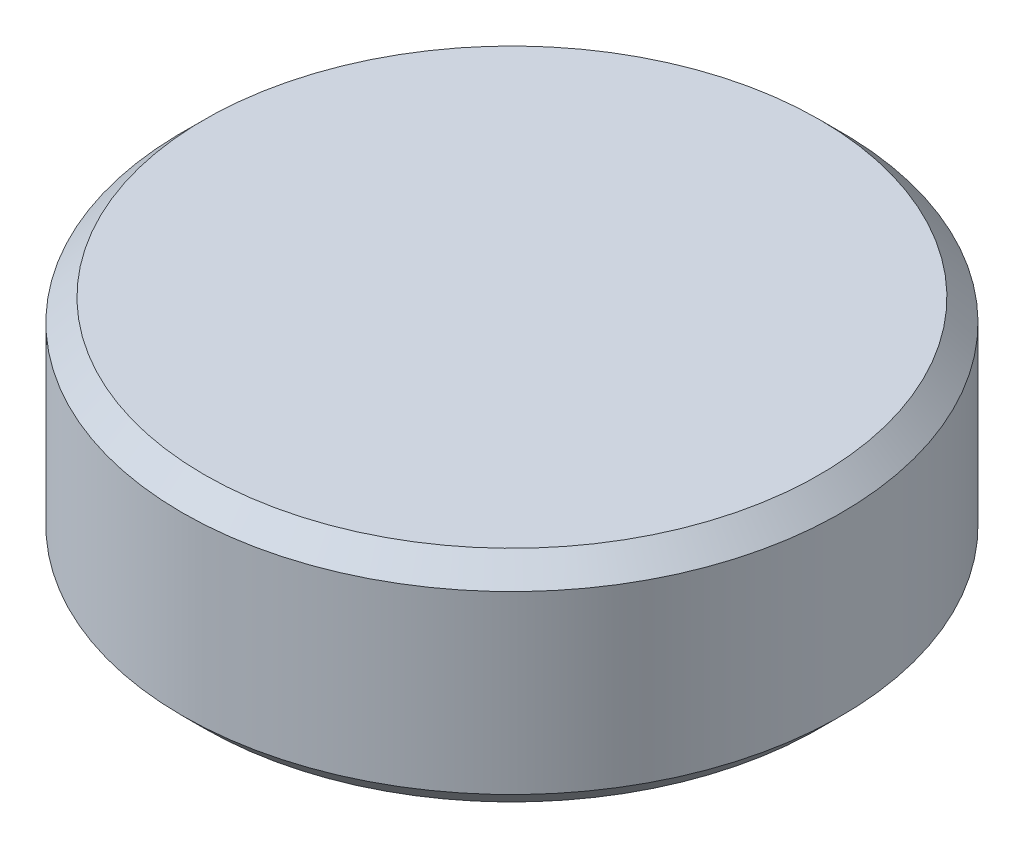
from build123d import *

# Parameters (mm, degrees)
SKETCH_1_R      = 30
EXTRUDE_1_DEPTH = 20
CHAMFER_1_SIZE  = 2


with BuildPart() as part:
    # Эскиз1 → Бобышка-Вытянуть1 (new body)
    with BuildSketch(Plane(origin=(0, 0, 0), x_dir=(1, 0, 0), z_dir=(0, 1, 0))):
        with Locations(Location((0, 0, 0), (0, 0, 270))):
            Circle(SKETCH_1_R)
    extrude(amount=EXTRUDE_1_DEPTH)

    # Фаска1
    chamfer_1_edges = [part.edges().sort_by_distance(p)[0] for p in [
        (0, 0, -30),
        (0, 20, -30),
    ]]
    chamfer(chamfer_1_edges, length=CHAMFER_1_SIZE)


solid = part.part
